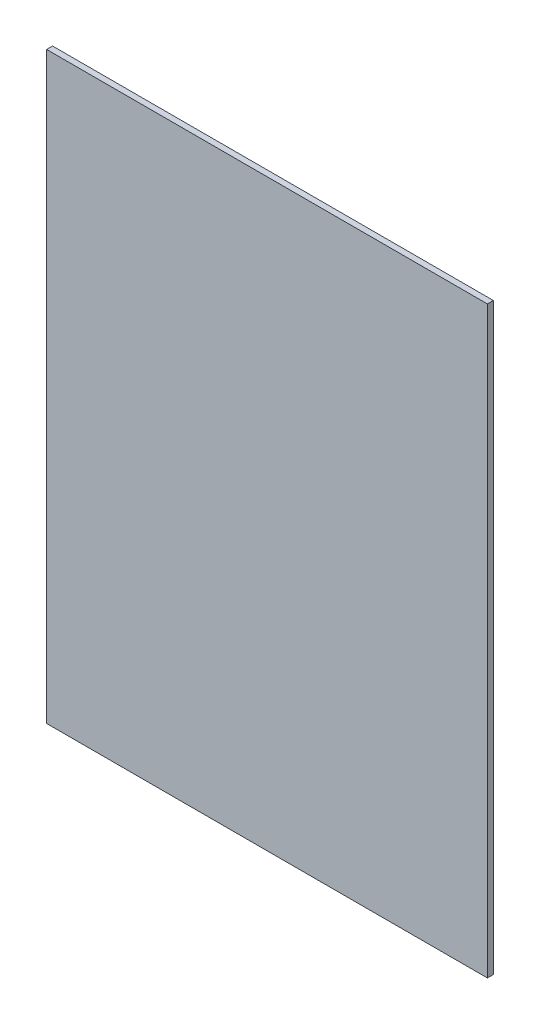
from build123d import *

# Parameters (mm, degrees)
SKETCH1_W           = 234.95
SKETCH1_H           = 311.15
BOSS_EXTRUDE1_DEPTH = 3.175


with BuildPart() as part:
    # Sketch1 → Boss-Extrude1 (new body)
    with BuildSketch(Plane.XY):
        Rectangle(SKETCH1_W, SKETCH1_H)
    extrude(amount=BOSS_EXTRUDE1_DEPTH)


solid = part.part
